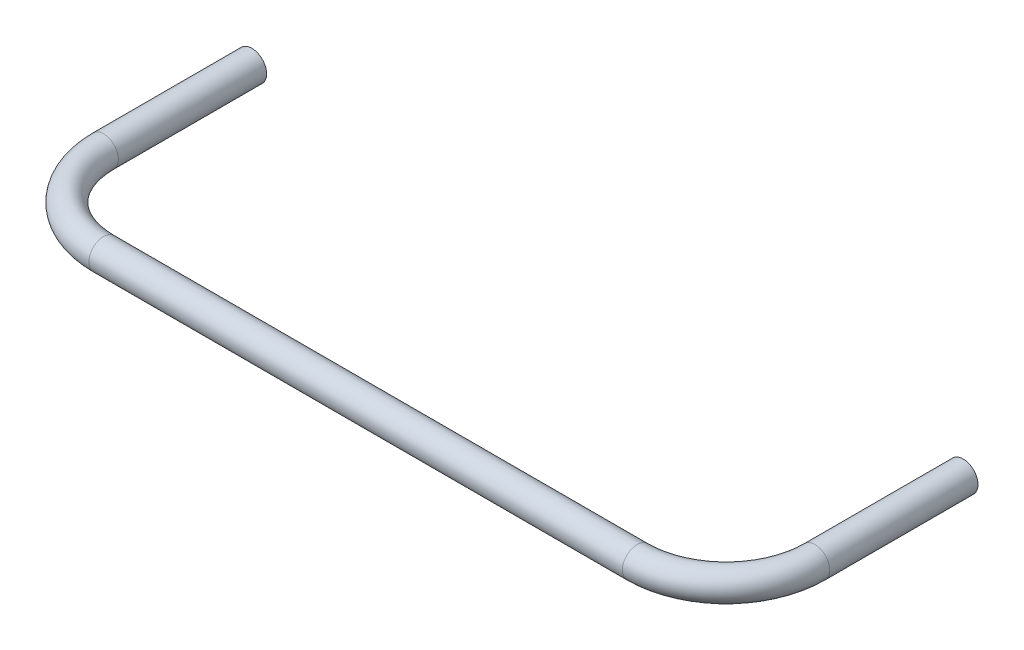
from build123d import *

# Parameters (mm, degrees)
SWEEP1_PROFILE_R = 6.35


with BuildPart() as part:
    # Sweep1: sweep along a path in Sketch2
    with BuildLine(Plane(origin=(0, 0, 0), x_dir=(1, 0, 0), z_dir=(0, 1, 0))) as sweep1_path:
        Line((152.4, 101.6), (152.4, 38.1))
        ThreePointArc((152.4, 38.1), (141.240768363, 11.159231637), (114.3, 0))
        Line((114.3, 0), (-114.3, 0))
        ThreePointArc((-114.3, 0), (-141.240768363, 11.159231637), (-152.4, 38.1))
        Line((-152.4, 38.1), (-152.4, 101.6))
    # Sweep1 profile (on start of the path) → Sweep1 (sweep)
    with BuildSketch(Plane(origin=(152.4, 0, -101.6), x_dir=(1, 0, 0), z_dir=(0, 0, 1))):
        Circle(SWEEP1_PROFILE_R)
    sweep(path=sweep1_path.line)


solid = part.part
